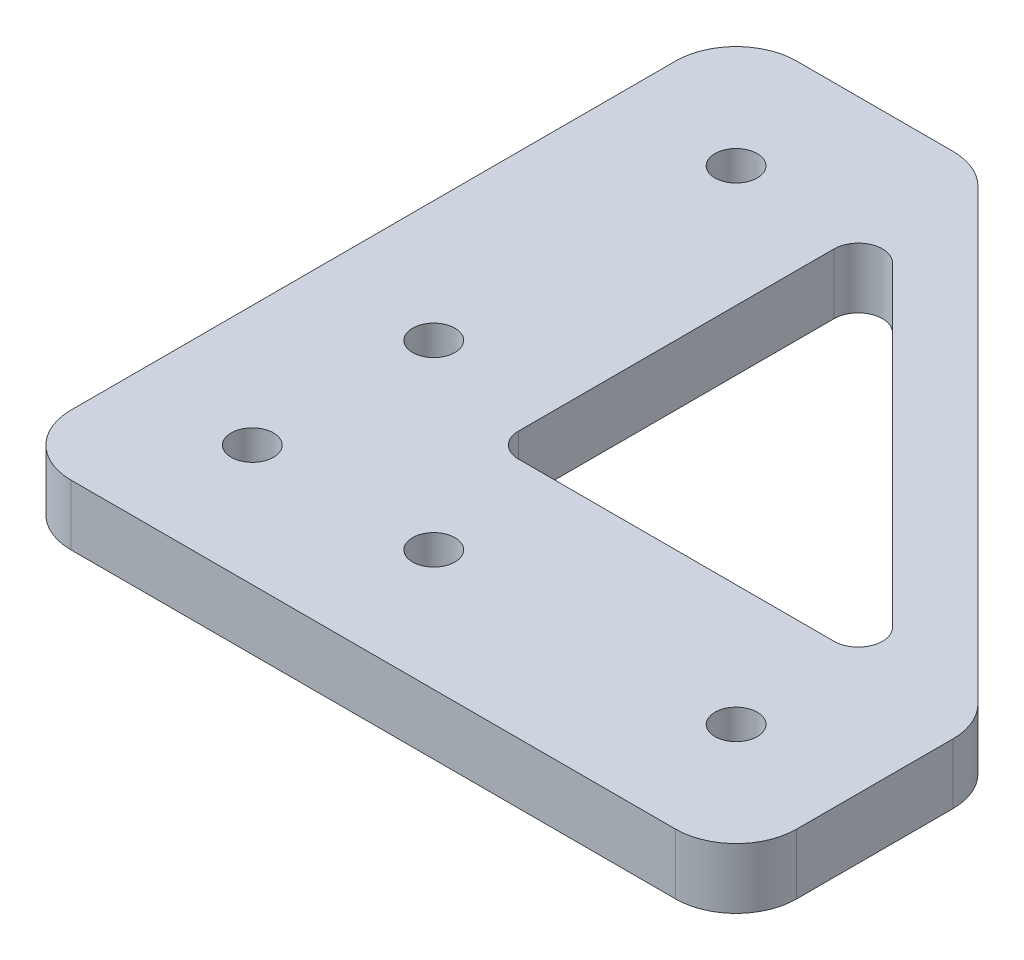
from build123d import *

# Parameters (mm, degrees)
ESBO_O1_R                = 1.75
RESSALTO_EXTRUS_O1_DEPTH = 5
FILETE2_R                = 2
ESBO_O4_R                = 1.75
CORTE_EXTRUS_O1_DEPTH    = 10
FILETE3_R                = 5


with BuildPart() as part:
    # Esboço1 → Ressalto-extrusão1 (new body)
    # profile 1 of 2: a face of its own
    with BuildSketch(Plane(origin=(0, 0, 0), x_dir=(1, 0, 0), z_dir=(0, 1, 0))):
        Polygon((52.928932188, 20), (60, 20), (60, 0), (0, 0), (0, 60), (20, 60), (20, 52.928932188), (20, 20), align=None)
        with Locations(Location((10, 10, 0), (0, 0, 270))):
            Circle(ESBO_O1_R, mode=Mode.SUBTRACT)
        with Locations(Location((50, 10, 0), (0, 0, 270))):
            Circle(ESBO_O1_R, mode=Mode.SUBTRACT)
        with Locations(Location((10, 50, 0), (0, 0, 270))):
            Circle(ESBO_O1_R, mode=Mode.SUBTRACT)
    # profile 2 of 2: a face of its own
    with BuildSketch(Plane(origin=(0, 0, 0), x_dir=(1, 0, 0), z_dir=(0, 1, 0))):
        Polygon((52.928932188, 20), (20, 52.928932188), (20, 60), (60, 20), align=None)
    extrude(amount=RESSALTO_EXTRUS_O1_DEPTH)

    # Filete2
    filete2_edges = [part.edges().sort_by_distance(p)[0] for p in [
        (52.928932188, 2.5, -20),
        (20, 2.5, -52.928932188),
        (20, 2.5, -20),
    ]]
    fillet(filete2_edges, radius=FILETE2_R)

    # Esboço4 → Corte-extrusão1 (cut)
    with BuildSketch(Plane.XZ):
        with Locations(Location((10, -25, 0), (0, 0, 270))):
            Circle(ESBO_O4_R)
        with Locations(Location((25, -10, 0), (0, 0, 270))):
            Circle(ESBO_O4_R)
    extrude(amount=-CORTE_EXTRUS_O1_DEPTH, mode=Mode.SUBTRACT)

    # Filete3
    filete3_edges = [part.edges().sort_by_distance(p)[0] for p in [
        (60, 2.5, 0),
        (0, 2.5, 0),
        (0, 2.5, -60),
        (20, 2.5, -60),
        (60, 2.5, -20),
    ]]
    fillet(filete3_edges, radius=FILETE3_R)


solid = part.part
